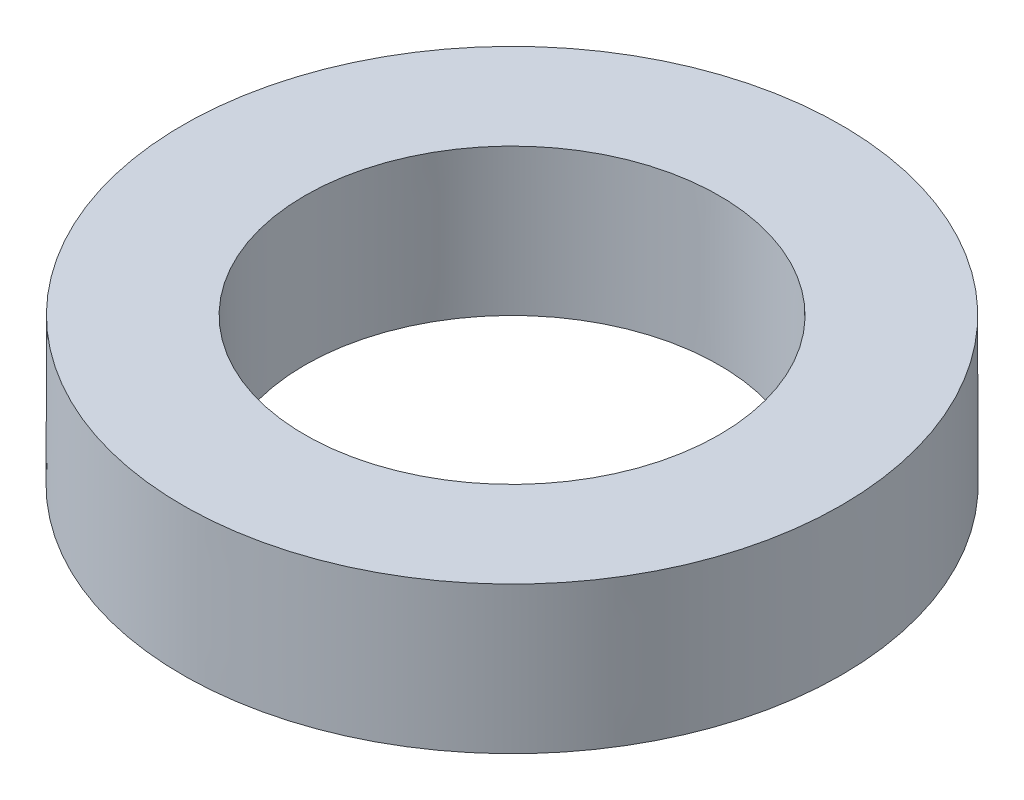
from build123d import *

# Parameters (mm, degrees)
IZIM1_R = 0.664224489


with BuildPart() as part:
    # Çizim1 → Döndür1 (revolve)
    with BuildSketch(Plane.XY):
        Polygon((9.797869568, -0.000479001), (15.584784572, -0.000479001), (15.571934006, 6.937283218), (9.797869568, 6.937283218), align=None)
        with Locations((12.684901787, 3.468402108)):
            Circle(IZIM1_R, mode=Mode.SUBTRACT)
    revolve(axis=Axis((0, 0, 0), (4.888832334750329e-05, 0.9999999988049659, 0)))


solid = part.part
